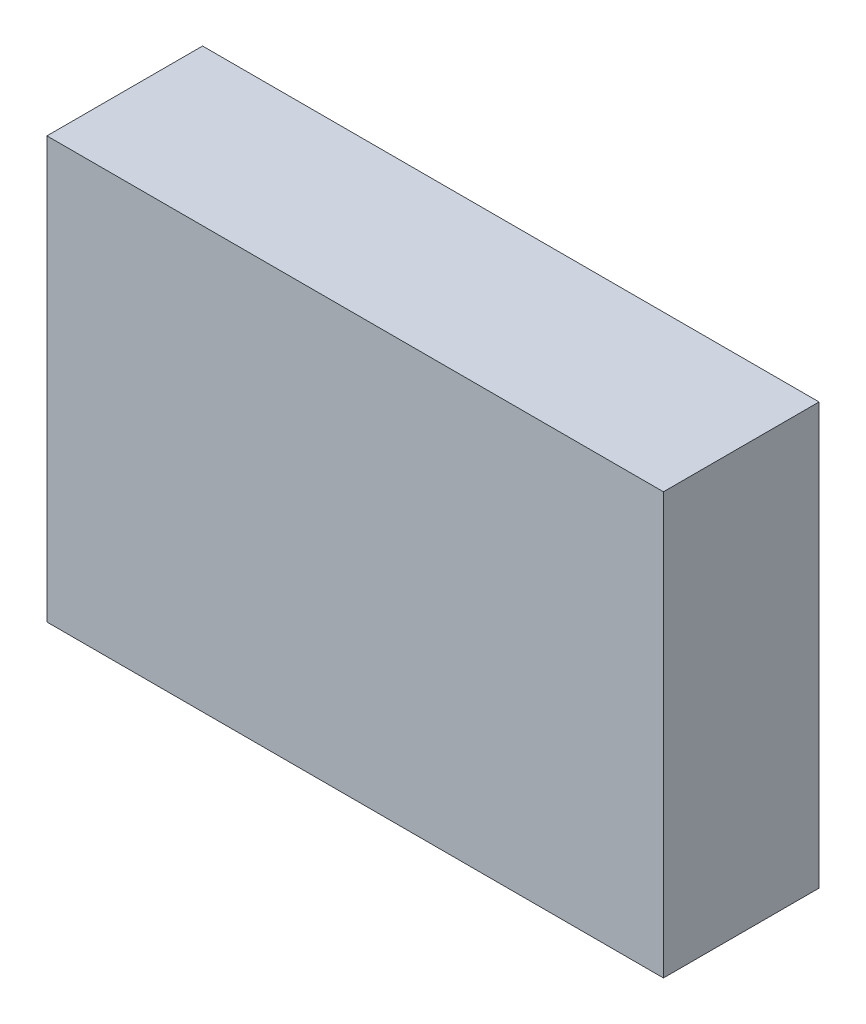
from build123d import *

# Parameters (mm, degrees)
SKETCH_1_W      = 206
SKETCH_1_H      = 140.7
EXTRUDE_1_DEPTH = 52


with BuildPart() as part:
    # 草图1 → 凸台-拉伸1 (new body)
    with BuildSketch(Plane.XY):
        with Locations((-103, 70.35)):
            Rectangle(SKETCH_1_W, SKETCH_1_H)
    extrude(amount=EXTRUDE_1_DEPTH)


solid = part.part
